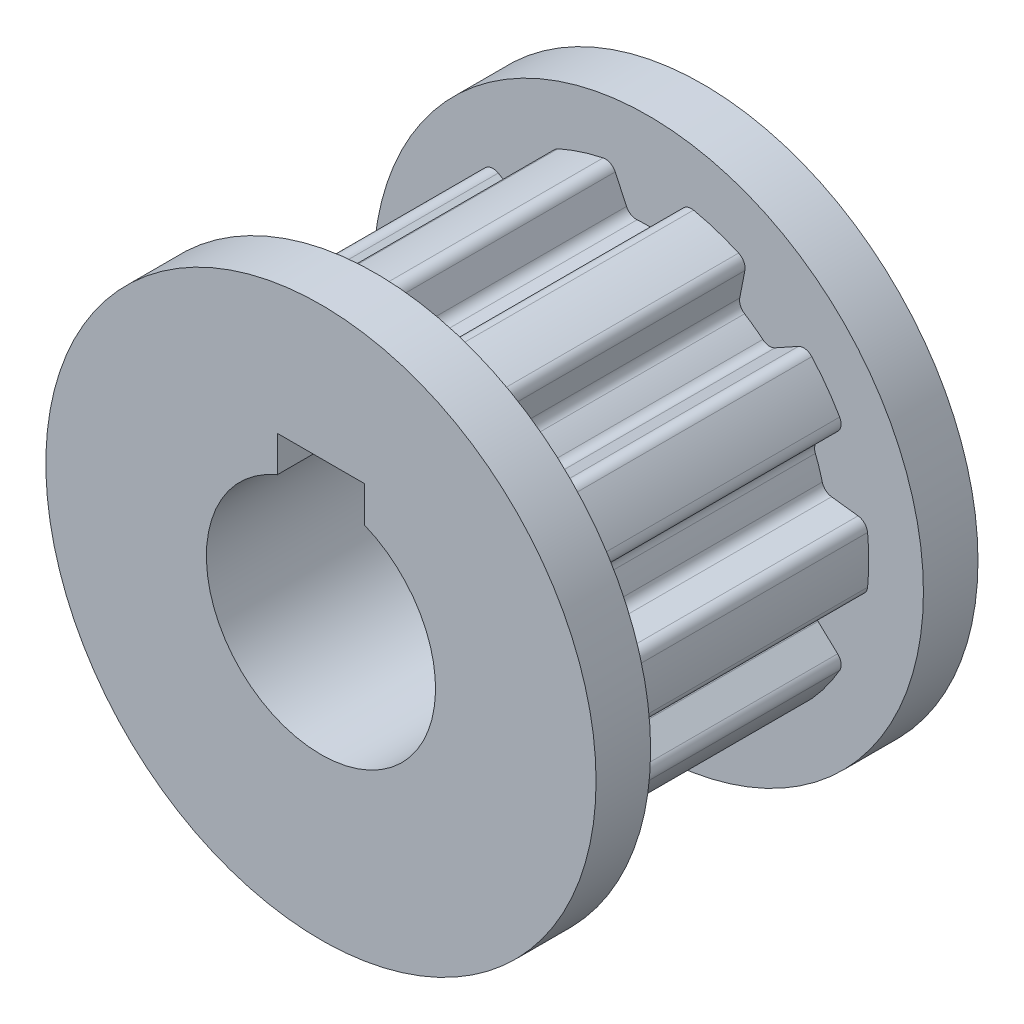
from build123d import *

# Parameters (mm, degrees)
CUT_EXTRUDE4_REACH             = 17.888
CUT_EXTRUDE4_DIRECTION_2_REACH = 17.888
CIRPATTERN1_COUNT              = 10
SKETCH2_R                      = 4.2
CUT_EXTRUDE1_DEPTH             = 20.985427655
SKETCH7_W                      = 3.2
SKETCH7_H                      = 5.2
CUT_EXTRUDE5_DEPTH             = 20.985427655
SKETCH3_R                      = 1.25
CUT_EXTRUDE2_DEPTH             = 20.985427655
SKETCH4_R                      = 1.25
CUT_EXTRUDE3_DEPTH             = 20.985427725


with BuildPart() as part:
    # Sketch1 → Revolve1 (revolve)
    with BuildSketch(Plane(origin=(0, 0, 0), x_dir=(1, 0, 0), z_dir=(0, 1, 0)), mode=Mode.PRIVATE) as revolve1_sk:
        Polygon((0, 14), (-10.085071109, 14), (-10.085071109, 12), (-8.085071109, 12), (-8.085071109, 2), (-10.085071109, 2), (-10.085071109, 0), (0, 0), align=None)
    revolve(revolve1_sk.sketch.rotate(Axis((0, 0, 0), (0, 0, -1)), 180), axis=Axis((0, 0, 0), (0, 0, -1)))

    # Cut-Extrude4: up to this face of the body (flat: up to its plane)
    cut_extrude4_end = Plane(part.part.faces().sort_by_distance((-9.799822222, 0, -12))[0])
    # Sketch6 → Cut-Extrude4 (cut, up to the picked face)
    with BuildSketch(Plane.XY.offset(-7), mode=Mode.PRIVATE) as cut_extrude4_sk1:
        with BuildLine():
            Line((-0.798419844, 6.802409676), (-1.212747437, 7.690938067))
            ThreePointArc((-1.212747437, 7.690938067), (-1.396254976, 7.87959654), (-1.657261754, 7.913397394))
            ThreePointArc((-1.657261754, 7.913397394), (0, 8.085071109), (1.657261754, 7.913397394))
            ThreePointArc((1.657261754, 7.913397394), (1.396254976, 7.87959654), (1.212747437, 7.690938067))
            Line((1.212747437, 7.690938067), (0.798419844, 6.802409676))
            ThreePointArc((0.798419844, 6.802409676), (0.640180484, 6.627555618), (0.410935109, 6.572236594))
            ThreePointArc((0.410935109, 6.572236594), (0, 6.585071109), (-0.410935109, 6.572236594))
            ThreePointArc((-0.410935109, 6.572236594), (-0.640180484, 6.627555618), (-0.798419844, 6.802409676))
        make_face()
    cut_extrude4_tool1 = split(extrude(cut_extrude4_sk1.sketch, amount=-CUT_EXTRUDE4_REACH, mode=Mode.PRIVATE), bisect_by=cut_extrude4_end, keep=Keep.BOTH, mode=Mode.PRIVATE)
    cut_extrude4 = cut_extrude4_tool1.solids().sort_by(Axis((0, 7.405314, -7), (0, 0, -1)))[0]
    add(cut_extrude4, mode=Mode.SUBTRACT)

    # Cut-Extrude4 direction 2: up to this face of the body (flat: up to its plane)
    cut_extrude4_direction_2_end = Plane(part.part.faces().sort_by_distance((-8.370319996, 0, -2))[0])
    # Sketch6 → Cut-Extrude4 direction 2 (cut, up to the picked face)
    with BuildSketch(Plane.XY.offset(-7), mode=Mode.PRIVATE) as cut_extrude4_direction_2_sk1:
        with BuildLine():
            Line((-0.798419844, 6.802409676), (-1.212747437, 7.690938067))
            ThreePointArc((-1.212747437, 7.690938067), (-1.396254976, 7.87959654), (-1.657261754, 7.913397394))
            ThreePointArc((-1.657261754, 7.913397394), (0, 8.085071109), (1.657261754, 7.913397394))
            ThreePointArc((1.657261754, 7.913397394), (1.396254976, 7.87959654), (1.212747437, 7.690938067))
            Line((1.212747437, 7.690938067), (0.798419844, 6.802409676))
            ThreePointArc((0.798419844, 6.802409676), (0.640180484, 6.627555618), (0.410935109, 6.572236594))
            ThreePointArc((0.410935109, 6.572236594), (0, 6.585071109), (-0.410935109, 6.572236594))
            ThreePointArc((-0.410935109, 6.572236594), (-0.640180484, 6.627555618), (-0.798419844, 6.802409676))
        make_face()
    cut_extrude4_direction_2_tool1 = split(extrude(cut_extrude4_direction_2_sk1.sketch, amount=CUT_EXTRUDE4_DIRECTION_2_REACH, mode=Mode.PRIVATE), bisect_by=cut_extrude4_direction_2_end, keep=Keep.BOTH, mode=Mode.PRIVATE)
    cut_extrude4_direction_2 = cut_extrude4_direction_2_tool1.solids().sort_by(Axis((0, 7.405314, -7), (0, 0, 1)))[0]
    add(cut_extrude4_direction_2, mode=Mode.SUBTRACT)

    # CirPattern1: Cut-Extrude4, Cut-Extrude4 direction 2 ×10 about axis
    cirpattern1_axis = Axis((0, 0, 0), (0, 0, 1))
    add([cut_extrude4.rotate(cirpattern1_axis, i * 360 / CIRPATTERN1_COUNT) for i in range(1, CIRPATTERN1_COUNT)], mode=Mode.SUBTRACT)
    add([cut_extrude4_direction_2.rotate(cirpattern1_axis, i * 360 / CIRPATTERN1_COUNT) for i in range(1, CIRPATTERN1_COUNT)], mode=Mode.SUBTRACT)

    # Sketch2 → Cut-Extrude1 (cut, through all)
    with BuildSketch(Plane.XY):
        Circle(SKETCH2_R)
    extrude(amount=-CUT_EXTRUDE1_DEPTH, mode=Mode.SUBTRACT)

    # Sketch7 → Cut-Extrude5 (cut, through all)
    with BuildSketch(Plane.XY):
        with Locations((0, 2.6)):
            Rectangle(SKETCH7_W, SKETCH7_H)
    extrude(amount=-CUT_EXTRUDE5_DEPTH, mode=Mode.SUBTRACT)

    # Sketch3 → Cut-Extrude2 (cut, through all)
    with BuildSketch(Plane(origin=(0, 0, 0), x_dir=(1, 0, 0), z_dir=(0, 1, 0))):
        with Locations(Location((0, 7, 0), (0, 0, 270))):
            Circle(SKETCH3_R)
    extrude(amount=-CUT_EXTRUDE2_DEPTH, mode=Mode.SUBTRACT)

    # Sketch4 → Cut-Extrude3 (cut, through all)
    with BuildSketch(Plane(origin=(0, 0, 0), x_dir=(0, 0, -1), z_dir=(1, 0, 0))):
        with Locations((7, 0)):
            Circle(SKETCH4_R)
    extrude(amount=-CUT_EXTRUDE3_DEPTH, mode=Mode.SUBTRACT)


solid = part.part
